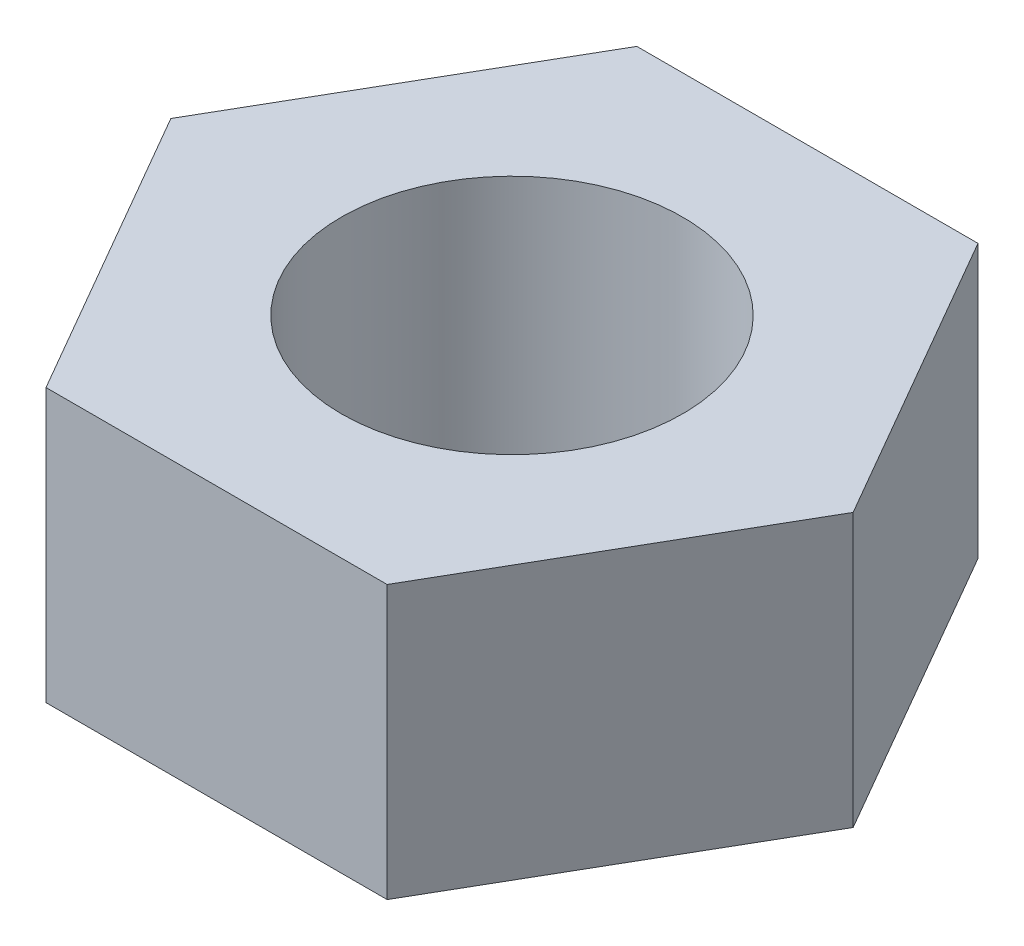
from build123d import *

# Parameters (mm, degrees)
SKETCH_1_R      = 1.25
EXTRUDE_1_DEPTH = 2


with BuildPart() as part:
    # 草图1 → 凸台-拉伸1 (new body)
    with BuildSketch(Plane(origin=(0, 0, 0), x_dir=(1, 0, 0), z_dir=(0, 1, 0))):
        Polygon((1.25, 2.165063509), (-1.25, 2.165063509), (-2.5, 0), (-1.25, -2.165063509), (1.25, -2.165063509), (2.5, 0), align=None)
        with Locations(Location((0, 0, 0), (0, 0, 270))):
            Circle(SKETCH_1_R, mode=Mode.SUBTRACT)
    extrude(amount=EXTRUDE_1_DEPTH)


solid = part.part
